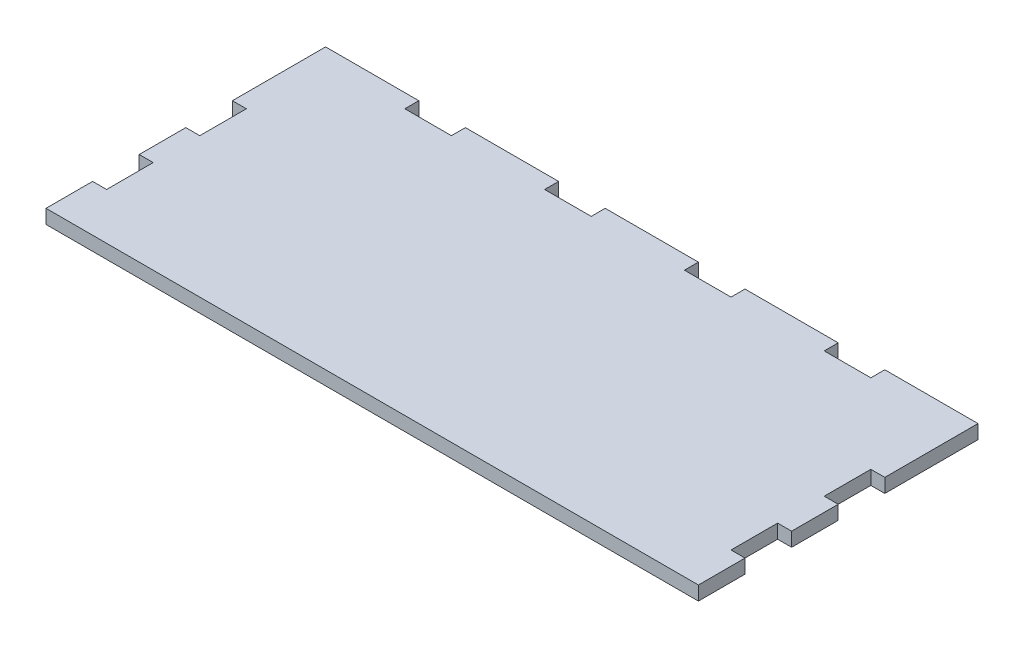
from build123d import *

# Parameters (mm, degrees)
SKETCH1_W           = 140
SKETCH1_H           = 60
BOSS_EXTRUDE1_DEPTH = 3
SKETCH2_W           = 3
SKETCH2_H           = 10
CUT_EXTRUDE1_DEPTH  = 10
SKETCH3_W           = 10
SKETCH3_H           = 3
CUT_EXTRUDE2_DEPTH  = 13


with BuildPart() as part:
    # Sketch1 → Boss-Extrude1 (new body)
    with BuildSketch(Plane(origin=(0, 0, 0), x_dir=(1, 0, 0), z_dir=(0, 1, 0))):
        Rectangle(SKETCH1_W, SKETCH1_H)
    extrude(amount=BOSS_EXTRUDE1_DEPTH)

    # Sketch2 → Cut-Extrude1 (cut)
    with BuildSketch(Plane(origin=(0, 3, 0), x_dir=(1, 0, 0), z_dir=(0, 1, 0))):
        with Locations((68.5, -15)):
            Rectangle(SKETCH2_W, SKETCH2_H)
        with Locations((68.5, 5)):
            Rectangle(SKETCH2_W, SKETCH2_H)
        with Locations((-68.5, -15)):
            Rectangle(SKETCH2_W, SKETCH2_H)
        with Locations((-68.5, 5)):
            Rectangle(SKETCH2_W, SKETCH2_H)
    extrude(amount=-CUT_EXTRUDE1_DEPTH, mode=Mode.SUBTRACT)

    # Sketch3 → Cut-Extrude2 (cut)
    with BuildSketch(Plane(origin=(0, 3, 0), x_dir=(1, 0, 0), z_dir=(0, 1, 0))):
        with Locations((-45, 28.5)):
            Rectangle(SKETCH3_W, SKETCH3_H)
        with Locations((-15, 28.5)):
            Rectangle(SKETCH3_W, SKETCH3_H)
        with Locations((15, 28.5)):
            Rectangle(SKETCH3_W, SKETCH3_H)
        with Locations((45, 28.5)):
            Rectangle(SKETCH3_W, SKETCH3_H)
    extrude(amount=-CUT_EXTRUDE2_DEPTH, mode=Mode.SUBTRACT)


solid = part.part
